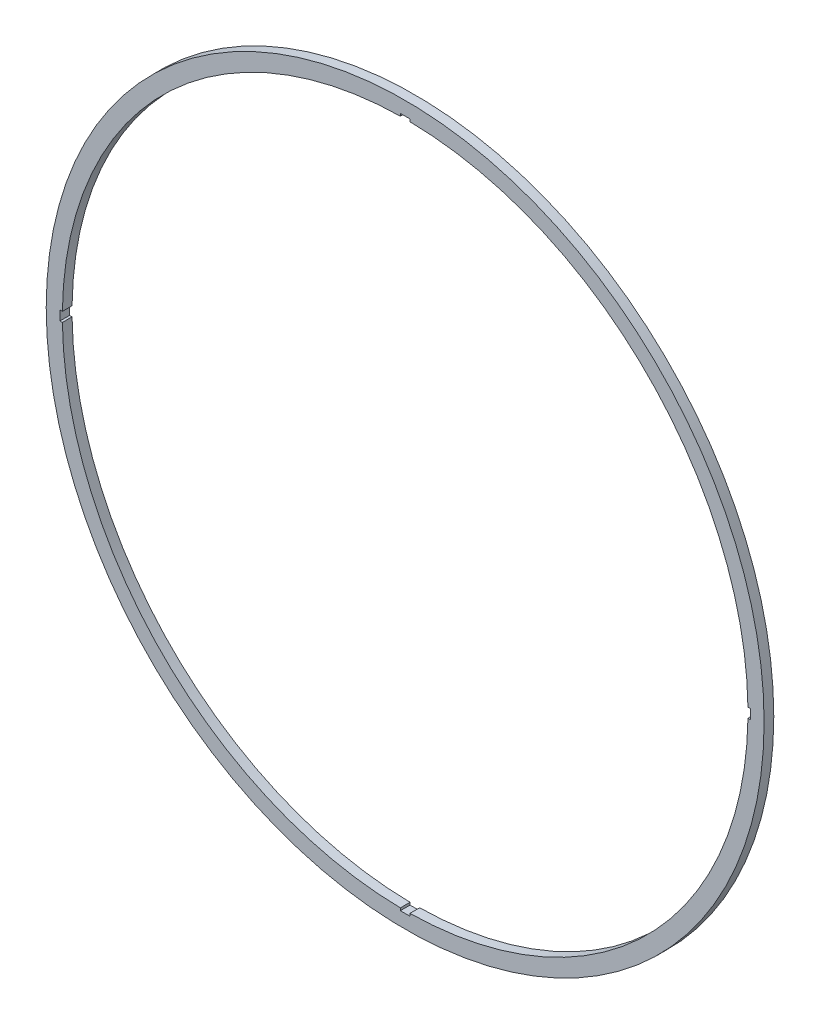
from build123d import *

# Parameters (mm, degrees)
SKETCH1_R           = 445
BOSS_EXTRUDE1_DEPTH = 12


with BuildPart() as part:
    # Sketch1 → Boss-Extrude1 (new body)
    with BuildSketch(Plane.XY):
        Circle(SKETCH1_R)
        with BuildLine():
            Line((428.000486773, 5.930232558), (424.95862427, 5.930232558))
            ThreePointArc((424.95862427, 5.930232558), (300.520382004, 300.520382004), (5.930232558, 424.95862427))
            Line((5.930232558, 424.95862427), (5.930232558, 428.000486773))
            Line((5.930232558, 428.000486773), (-5.930232558, 428.000486773))
            Line((-5.930232558, 428.000486773), (-5.930232558, 424.95862427))
            ThreePointArc((-5.930232558, 424.95862427), (-300.520382004, 300.520382004), (-424.95862427, 5.930232558))
            Line((-424.95862427, 5.930232558), (-428.000486773, 5.930232558))
            Line((-428.000486773, 5.930232558), (-428.000486773, -5.930232558))
            Line((-428.000486773, -5.930232558), (-424.95862427, -5.930232558))
            ThreePointArc((-424.95862427, -5.930232558), (-300.520382004, -300.520382004), (-5.930232558, -424.95862427))
            Line((-5.930232558, -424.95862427), (-5.930232558, -428.000486773))
            Line((-5.930232558, -428.000486773), (5.930232558, -428.000486773))
            Line((5.930232558, -428.000486773), (5.930232558, -424.95862427))
            ThreePointArc((5.930232558, -424.95862427), (300.520382004, -300.520382004), (424.95862427, -5.930232558))
            Line((424.95862427, -5.930232558), (428.000486773, -5.930232558))
            Line((428.000486773, -5.930232558), (428.000486773, 5.930232558))
        make_face(mode=Mode.SUBTRACT)
    extrude(amount=BOSS_EXTRUDE1_DEPTH)


solid = part.part
